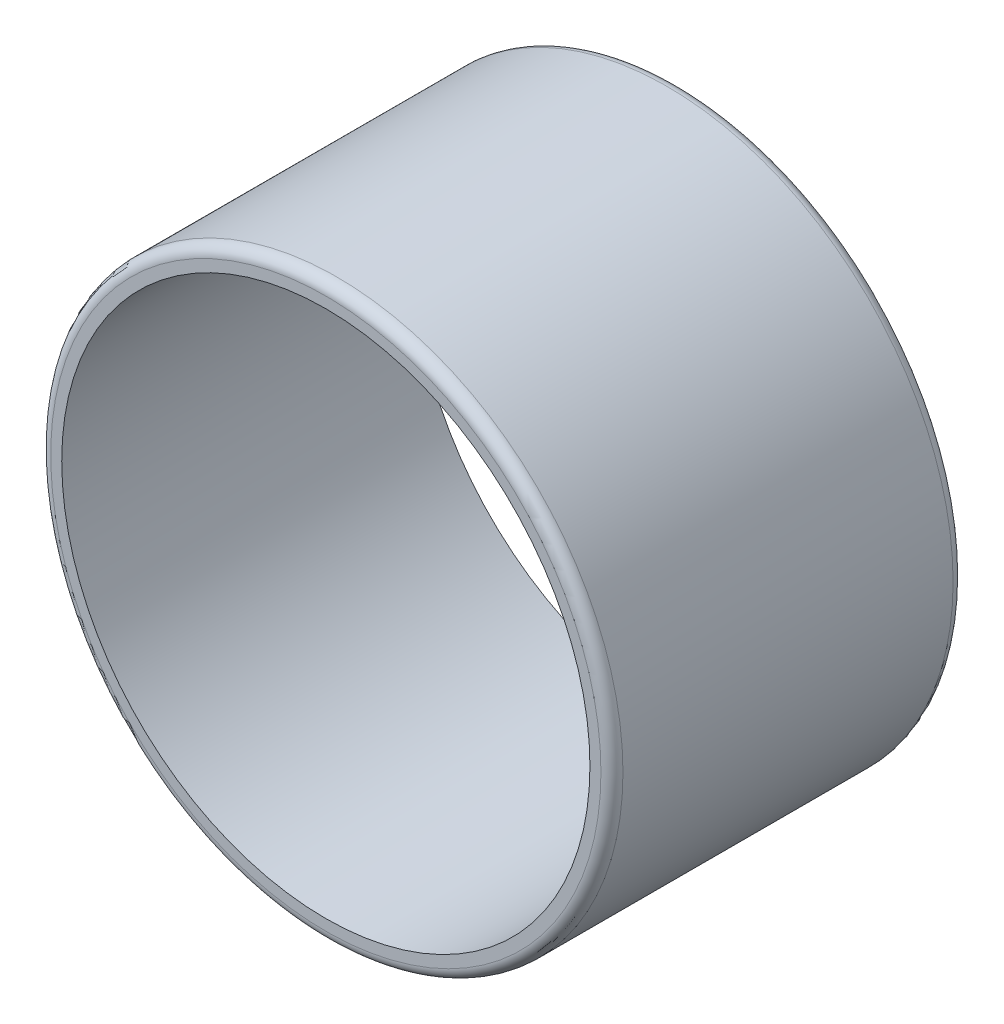
from build123d import *

# Parameters (mm, degrees)
ESQUISSE1_R      = 13
ESQUISSE1_R_2    = 12
EXTRUSION1_DEPTH = 8
CONG_1_R         = 0.5


with BuildPart() as part:
    # Esquisse1 → Extrusion1 (new, symmetric)
    with BuildSketch(Plane.XY):
        Circle(ESQUISSE1_R)
        Circle(ESQUISSE1_R_2, mode=Mode.SUBTRACT)
    extrude(amount=EXTRUSION1_DEPTH, both=True)

    # Congé1
    cong_1_edges = [part.edges().sort_by_distance(p)[0] for p in [
        (-13, 0, -8),
        (-13, 0, 8),
    ]]
    fillet(cong_1_edges, radius=CONG_1_R)


solid = part.part
